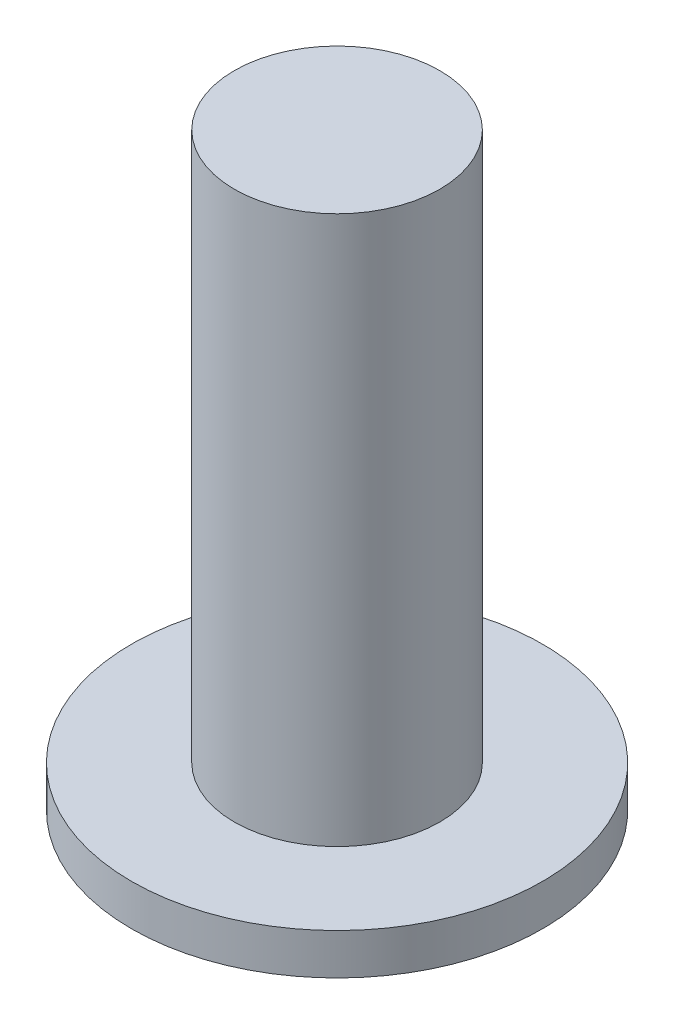
from build123d import *

# Parameters (mm, degrees)
SKETCH1_R           = 150
BOSS_EXTRUDE1_DEPTH = 30
SKETCH2_R           = 75
BOSS_EXTRUDE2_DEPTH = 400
SKETCH3_R           = 50
CUT_EXTRUDE1_DEPTH  = 100


with BuildPart() as part:
    # Sketch1 → Boss-Extrude1 (new body)
    with BuildSketch(Plane(origin=(0, 0, 0), x_dir=(1, 0, 0), z_dir=(0, 1, 0))):
        with Locations(Location((0, 0, 0), (0, 0, 270))):
            Circle(SKETCH1_R)
    extrude(amount=BOSS_EXTRUDE1_DEPTH)

    # Sketch2 → Boss-Extrude2 (add)
    with BuildSketch(Plane(origin=(0, 30, 0), x_dir=(1, 0, 0), z_dir=(0, 1, 0))):
        with Locations(Location((0, 0, 0), (0, 0, 270))):
            Circle(SKETCH2_R)
    extrude(amount=BOSS_EXTRUDE2_DEPTH)

    # Sketch3 → Cut-Extrude1 (cut)
    with BuildSketch(Plane(origin=(0, 0, -75), x_dir=(-1, 0, 0), z_dir=(0, 0, -1))):
        with Locations((0, 354.994876294)):
            Circle(SKETCH3_R)
    extrude(amount=-CUT_EXTRUDE1_DEPTH, mode=Mode.SUBTRACT)


solid = part.part
